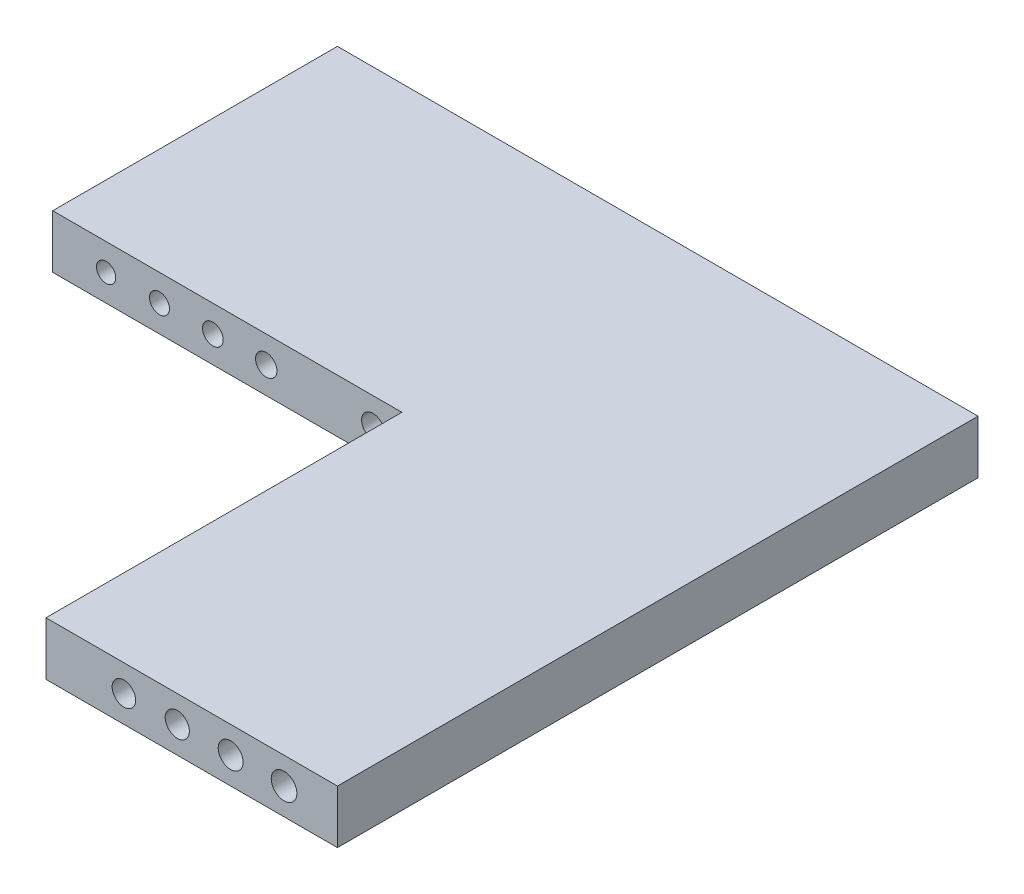
from build123d import *

# Parameters (mm, degrees)
SKETCH1_W           = 90
SKETCH1_H           = 7.5
SKETCH1_R           = 1.35
SKETCH1_R_2         = 1.4
SKETCH1_R_3         = 1.45
SKETCH1_R_4         = 1.5
SKETCH1_R_5         = 1.6
SKETCH1_R_6         = 1.65
SKETCH1_R_7         = 1.7
SKETCH1_R_8         = 1.8
SKETCH1_R_9         = 1.75
BOSS_EXTRUDE1_DEPTH = 90
SKETCH2_W           = 49.055817317
SKETCH2_H           = 7.5
CUT_EXTRUDE1_DEPTH  = 50


with BuildPart() as part:
    # Sketch1 → Boss-Extrude1 (new body)
    with BuildSketch(Plane.XY):
        Rectangle(SKETCH1_W, SKETCH1_H)
        with Locations(Location((-37.5, 0, 0), (0, 0, 180))):
            Circle(SKETCH1_R, mode=Mode.SUBTRACT)
        with Locations(Location((-30, 0, 0), (0, 0, 180))):
            Circle(SKETCH1_R_2, mode=Mode.SUBTRACT)
        with Locations(Location((-22.5, 0, 0), (0, 0, 180))):
            Circle(SKETCH1_R_3, mode=Mode.SUBTRACT)
        with Locations(Location((-15, 0, 0), (0, 0, 180))):
            Circle(SKETCH1_R_4, mode=Mode.SUBTRACT)
        with Locations(Location((0, 0, 0), (0, 0, 180))):
            Circle(SKETCH1_R_5, mode=Mode.SUBTRACT)
        with Locations(Location((15, 0, 0), (0, 0, 180))):
            Circle(SKETCH1_R_6, mode=Mode.SUBTRACT)
        with Locations(Location((22.5, 0, 0), (0, 0, 180))):
            Circle(SKETCH1_R_7, mode=Mode.SUBTRACT)
        with Locations(Location((37.5, 0, 0), (0, 0, 180))):
            Circle(SKETCH1_R_8, mode=Mode.SUBTRACT)
        with Locations(Location((30, 0, 0), (0, 0, 180))):
            Circle(SKETCH1_R_9, mode=Mode.SUBTRACT)
    extrude(amount=BOSS_EXTRUDE1_DEPTH)

    # Sketch2 → Cut-Extrude1 (cut)
    with BuildSketch(Plane.XY.offset(90)):
        with Locations((-20.472091342, 0)):
            Rectangle(SKETCH2_W, SKETCH2_H)
    extrude(amount=-CUT_EXTRUDE1_DEPTH, mode=Mode.SUBTRACT)


solid = part.part
